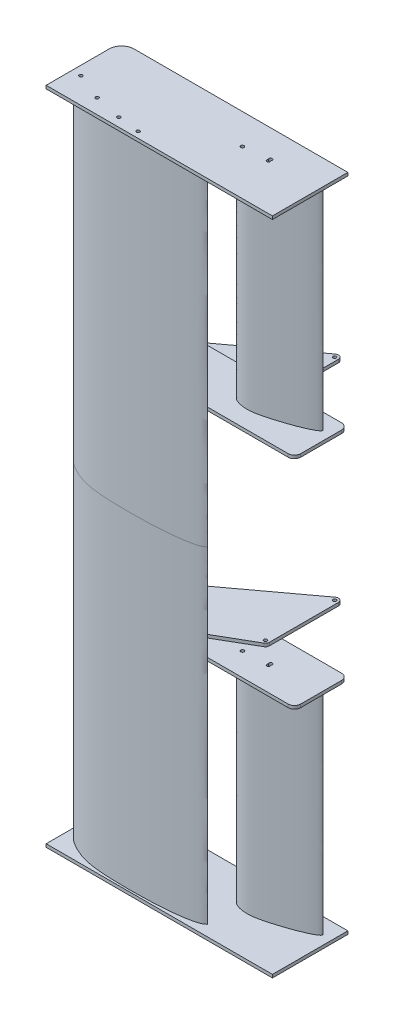
from build123d import *

# Parameters (mm, degrees)
MAIN_DEPTH              = 660.4
SKETCH2_W               = 457.2
SKETCH2_H               = 152.4
ENDPLATE_DEPTH          = 6.35
FILLET4_R               = 25.4
SECOND_DEPTH            = 438.15
SKETCH23_R              = 3.302
INNER_ENDPLATE_DEPTH    = 6.35
FILLET2_R               = 12.7
CUT_EXTRUDE4_DEPTH      = 676.928791664
CUT_EXTRUDE4_DEPTH_BACK = 676.928791664
SKETCH24_R              = 3.302
BRACKET_DEPTH           = 6.35
CUT_EXTRUDE1_DEPTH      = 1045.463627801
CUT_EXTRUDE1_DEPTH_BACK = 1045.463627801
SKETCH9_R               = 3.302


with BuildPart() as part:
    # Sketch1 → Main (new body)
    with BuildSketch(Plane(origin=(0, 0, 0), x_dir=(1, 0, 0), z_dir=(0, 1, 0))):
        with BuildLine():
            add(Edge.make_bspline(
                [(318.083845492, 47.259196978), (318.08297359, 47.267154189), (316.836850446, 46.62700977), (315.466403769, 46.011621914), (311.900786948, 44.424374903), (307.131660944, 42.819520456), (300.528834256, 41.236182285), (292.543042944, 39.972954123), (283.264489423, 39.014698092), (272.872069182, 38.443565802), (261.492469203, 38.305788402), (249.276802549, 38.627289353), (236.374254336, 39.434871831), (222.94005764, 40.719492576), (209.12856161, 42.470686101), (195.093442857, 44.665547934), (180.984437285, 47.25968123), (166.945903947, 50.201123123), (153.116363264, 53.441082277), (139.61983953, 56.894935575), (126.573330114, 60.495905864), (114.082486038, 64.157557775), (102.237618501, 67.797629829), (91.1177432, 71.324265433), (80.783504455, 74.640170192), (71.280367209, 77.687906441), (62.533724574, 80.261388665), (54.494573966, 82.320744222), (47.189919329, 84.053436628), (40.658043207, 85.472768156), (34.964856515, 86.556633324), (30.181047583, 87.352830974), (26.340381113, 87.686545767), (23.527915607, 87.890034883), (21.327636154, 87.155445312), (20.524324703, 85.231304501), (20.163398672, 83.070326582), (20.340649738, 80.44131285), (21.031931261, 77.531851422), (22.283339536, 74.403421576), (24.094422985, 71.123489385), (26.564942436, 67.774181889), (29.684577576, 64.383148263), (33.398862268, 60.924210695), (37.713795664, 57.460311883), (42.604896224, 54.034229147), (48.047577674, 50.681123894), (54.029926242, 47.457003136), (60.514509487, 44.379799377), (67.479018498, 41.505638203), (74.897272675, 38.873528205), (82.772968187, 36.57860894), (91.10761162, 34.617106723), (99.946095184, 33.070584061), (109.287355208, 31.901790166), (119.092438276, 30.937070462), (129.317209455, 30.231149487), (139.897617837, 29.72941602), (150.768654301, 29.397410733), (161.847925709, 29.18899276), (173.043707209, 29.09390494), (184.260705512, 29.091626097), (195.411742422, 29.202537859), (206.416770867, 29.431717071), (217.2049735, 29.775340643), (227.708273252, 30.244993817), (237.864632232, 30.825665152), (247.611165213, 31.522447797), (256.88943499, 32.319237716), (265.643009293, 33.213008254), (273.81964691, 34.197878974), (281.372108338, 35.26525725), (288.257812582, 36.40206553), (294.438418039, 37.603705661), (299.88101434, 38.857203766), (304.559654579, 40.152174252), (308.464413379, 41.463824945), (311.653686798, 42.920117293), (314.043297262, 44.459457329), (316.089209008, 45.930997418), (317.016522327, 46.641914263), (318.084700022, 47.251398314), (318.083845492, 47.259196978)],
                knots=[0, 0, 0, 0, 0.000999594, 0.004147435, 0.009748209, 0.018044377, 0.028864178, 0.04183079, 0.056713807, 0.073341232, 0.091507989, 0.111021837, 0.131661709, 0.153207715, 0.175433402, 0.198110317, 0.221011446, 0.243905882, 0.266573311, 0.288810349, 0.310405036, 0.331177743, 0.350943876, 0.3695564, 0.386864963, 0.402753039, 0.417195876, 0.430379519, 0.442362633, 0.453032156, 0.462284346, 0.470026206, 0.476176645, 0.480649947, 0.483553073, 0.486420689, 0.489953231, 0.494096927, 0.498850588, 0.50419675, 0.510125492, 0.516691031, 0.524011699, 0.532092122, 0.540897921, 0.550403414, 0.560581041, 0.571396483, 0.582828081, 0.594829641, 0.607347037, 0.620384325, 0.633968937, 0.648199967, 0.663193937, 0.678898581, 0.695226562, 0.712113221, 0.729459406, 0.747143117, 0.765009772, 0.782904928, 0.800688045, 0.818242105, 0.835449083, 0.852211621, 0.868429578, 0.884009363, 0.898854951, 0.912881827, 0.92601075, 0.938166771, 0.949289699, 0.959322172, 0.968216949, 0.97594822, 0.982474409, 0.987904723, 0.992516501, 0.996351138, 0.999020322, 1, 1, 1, 1], degree=3))
        make_face()
    extrude(amount=MAIN_DEPTH)


with BuildPart() as body_2:
    # Sketch2 → Endplate (new body)
    with BuildSketch(Plane(origin=(0, 660.4, 0), x_dir=(1, 0, 0), z_dir=(0, 1, 0))):
        with Locations((242.57, 101.6)):
            Rectangle(SKETCH2_W, SKETCH2_H)
    extrude(amount=ENDPLATE_DEPTH)

    # Fillet4
    fillet4_edges = [body_2.edges().sort_by_distance(p)[0] for p in [
        (13.97, 663.575, -177.8),
    ]]
    fillet(fillet4_edges, radius=FILLET4_R)


with BuildPart() as body_3:
    # Sketch3 → Second (new body)
    with BuildSketch(Plane(origin=(0, 660.4, 0), x_dir=(1, 0, 0), z_dir=(0, 1, 0))):
        with BuildLine():
            add(Edge.make_bspline(
                [(453.791162952, 145.42722665), (453.789582818, 145.430903949), (453.287326131, 144.942651799), (452.722004792, 144.448062717), (451.249129687, 143.16787405), (449.203367762, 141.70333033), (446.27767212, 139.981013571), (442.6439131, 138.209588311), (438.347434144, 136.395002656), (433.461765154, 134.602689583), (428.04072347, 132.873274469), (422.152774521, 131.241243271), (415.865333277, 129.741220746), (409.253946802, 128.391575714), (402.393947414, 127.209867743), (395.362164259, 126.20761035), (388.236684107, 125.385464349), (381.094128818, 124.739686823), (374.007864863, 124.267197804), (367.049565457, 123.945665146), (360.284935044, 123.760262553), (353.77712654, 123.685105434), (347.581347925, 123.694062486), (341.748808875, 123.754763237), (336.322729681, 123.829551483), (331.333246088, 123.8976096), (326.77481142, 123.849490836), (322.629823792, 123.658966509), (318.883790691, 123.419620339), (315.553072401, 123.143409206), (312.672415893, 122.829398564), (310.268633444, 122.510777177), (308.383425257, 122.108892598), (307.008890957, 121.795048735), (306.064208707, 121.122153258), (305.961385591, 120.084687984), (306.10471235, 118.998648974), (306.573789982, 117.767491404), (307.329649985, 116.477381083), (308.385346011, 115.164453098), (309.730799552, 113.860900499), (311.401705674, 112.620576146), (313.389087775, 111.455191876), (315.67072957, 110.344268526), (318.240298234, 109.318779289), (321.079834423, 108.395599386), (324.17244205, 107.587947162), (327.504237085, 106.92086088), (331.054699638, 106.397442914), (334.804957885, 106.0412686), (338.736791004, 105.867162755), (342.838058269, 105.921156912), (347.11003172, 106.201666917), (351.562253387, 106.754254682), (356.199660213, 107.560953161), (361.029012371, 108.533034566), (366.021206684, 109.690213663), (371.153600446, 110.99701463), (376.400146858, 112.427457244), (381.728194587, 113.94743443), (387.095384629, 115.538632824), (392.459152176, 117.177309647), (397.774833261, 118.860466206), (403.003411023, 120.578828254), (408.111582861, 122.320215279), (413.065103965, 124.080214888), (417.836505229, 125.842580262), (422.394973386, 127.600553772), (426.71492073, 129.337892543), (430.769806491, 131.044899771), (434.535511046, 132.711126788), (437.990702834, 134.32555926), (441.116933405, 135.875719386), (443.896541815, 137.353803549), (446.315688489, 138.748797228), (448.363485081, 140.051941457), (450.038810013, 141.249930848), (451.350879344, 142.412487151), (452.268447534, 143.497853492), (453.031586758, 144.500557237), (453.371057842, 144.976043905), (453.792711602, 145.42362262), (453.791162952, 145.42722665)],
                knots=[0, 0, 0, 0, 0.000999594, 0.004147435, 0.009748209, 0.018044377, 0.028864178, 0.04183079, 0.056713807, 0.073341232, 0.091507989, 0.111021837, 0.131661709, 0.153207715, 0.175433402, 0.198110317, 0.221011446, 0.243905882, 0.266573311, 0.288810349, 0.310405036, 0.331177743, 0.350943876, 0.3695564, 0.386864963, 0.402753039, 0.417195876, 0.430379519, 0.442362633, 0.453032156, 0.462284346, 0.470026206, 0.476176645, 0.480649947, 0.483553073, 0.486420689, 0.489953231, 0.494096927, 0.498850588, 0.50419675, 0.510125492, 0.516691031, 0.524011699, 0.532092122, 0.540897921, 0.550403414, 0.560581041, 0.571396483, 0.582828081, 0.594829641, 0.607347037, 0.620384325, 0.633968937, 0.648199967, 0.663193937, 0.678898581, 0.695226562, 0.712113221, 0.729459406, 0.747143117, 0.765009772, 0.782904928, 0.800688045, 0.818242105, 0.835449083, 0.852211621, 0.868429578, 0.884009363, 0.898854951, 0.912881827, 0.92601075, 0.938166771, 0.949289699, 0.959322172, 0.968216949, 0.97594822, 0.982474409, 0.987904723, 0.992516501, 0.996351138, 0.999020322, 1, 1, 1, 1], degree=3))
        make_face()
    extrude(amount=-SECOND_DEPTH)


with BuildPart() as body_4:
    # Sketch23 → Inner Endplate (new body)
    with BuildSketch(Plane.XZ.offset(-222.25)):
        with BuildLine():
            Line((57.603623129, -84.451529159), (168.884811336, -52.874392631))
            ThreePointArc((168.884811336, -52.874392631), (171.908658894, -52.643642451), (174.783029089, -53.610542486))
            Line((174.783029089, -53.610542486), (202.831083849, -69.85))
            Line((202.831083849, -69.85), (471.17, -69.85))
            Line((471.17, -69.85), (471.17, -177.8))
            Line((471.17, -177.8), (163.040808988, -177.8))
            Line((163.040808988, -177.8), (55.149058286, -97.905918497))
            ThreePointArc((55.149058286, -97.905918497), (52.187476766, -90.414524286), (57.603623129, -84.451529159))
        make_face()
        with Locations((330.2, -152.4)):
            Circle(SKETCH23_R, mode=Mode.SUBTRACT)
        with Locations((59.683749039, -91.782114142)):
            Circle(SKETCH23_R, mode=Mode.SUBTRACT)
        with Locations((170.964937246, -60.204977615)):
            Circle(SKETCH23_R, mode=Mode.SUBTRACT)
    extrude(amount=INNER_ENDPLATE_DEPTH)

    # Fillet2
    fillet2_edges = [body_4.edges().sort_by_distance(p)[0] for p in [
        (202.831083849, 219.075, -69.85),
        (471.17, 219.075, -69.85),
        (471.17, 219.075, -177.8),
        (163.040808988, 219.075, -177.8),
    ]]
    fillet(fillet2_edges, radius=FILLET2_R)


with BuildPart() as cut_extrude4_tool:
    # Sketch24 → Cut-Extrude4 (new, two sides: drawn at the far end of the back side and taken through both)
    with BuildSketch(Plane.XZ.offset(-215.9).offset(-CUT_EXTRUDE4_DEPTH_BACK)):
        with Locations((319.459191206, -116.582508471)):
            Circle(SKETCH24_R)
        with Locations((143.277879936, -43.131921136)):
            Circle(SKETCH24_R)
        with Locations((87.172963634, -55.138888562)):
            Circle(SKETCH24_R)
        with Locations((32.306239861, -77.230124888)):
            Circle(SKETCH24_R)
        with Locations((187.396556376, -37.714828821)):
            Circle(SKETCH24_R)
        with BuildLine():
            ThreePointArc((368.235920218, -119.966991334), (370.271857189, -125.664240866), (373.07512826, -120.30277065))
            ThreePointArc((373.07512826, -120.30277065), (371.039191289, -114.605521118), (368.235920218, -119.966991334))
        make_face()
    extrude(amount=CUT_EXTRUDE4_DEPTH + CUT_EXTRUDE4_DEPTH_BACK)


with BuildPart() as body_2_1:
    add(body_2.part)

    # Cut-Extrude4: cut by cut_extrude4_tool
    add(cut_extrude4_tool.part, mode=Mode.SUBTRACT)


with BuildPart() as body_4_1:
    add(body_4.part)

    # Cut-Extrude4: cut by cut_extrude4_tool
    add(cut_extrude4_tool.part, mode=Mode.SUBTRACT)


with BuildPart() as body_5:
    # Mirror1: mirrored copy
    add(body_2_1.part.mirror(Plane(origin=(21.295918577, 0, -76.987198967), x_dir=(0, 0, 1), z_dir=(0, -1, 0))))


with BuildPart() as body_6:
    # Mirror1 2: mirrored copy
    add(body_3.part.mirror(Plane(origin=(21.295918577, 0, -76.987198967), x_dir=(0, 0, 1), z_dir=(0, -1, 0))))


with BuildPart() as body_7:
    # Mirror1 3: mirrored copy
    add(part.part.mirror(Plane(origin=(21.295918577, 0, -76.987198967), x_dir=(0, 0, 1), z_dir=(0, -1, 0))))


with BuildPart() as body_8:
    # Mirror1 4: mirrored copy
    add(body_4_1.part.mirror(Plane(origin=(21.295918577, 0, -76.987198967), x_dir=(0, 0, 1), z_dir=(0, -1, 0))))


with BuildPart() as body_9:
    # Sketch8 → Bracket (new body)
    with BuildSketch(Plane.XZ.offset(-215.9)):
        with BuildLine():
            Line((55.149058286, -97.905918497), (325.665309247, -298.223804355))
            ThreePointArc((325.665309247, -298.223804355), (333.628560665, -298.905098954), (337.82, -292.1))
            Line((337.82, -292.1), (337.82, -152.4))
            ThreePointArc((337.82, -152.4), (336.801449078, -148.594048072), (334.018091844, -145.805564871))
            Line((334.018091844, -145.805564871), (174.783029089, -53.610542486))
            ThreePointArc((174.783029089, -53.610542486), (171.908658894, -52.643642451), (168.884811336, -52.874392631))
            Line((168.884811336, -52.874392631), (57.603623129, -84.451529159))
            ThreePointArc((57.603623129, -84.451529159), (52.187476766, -90.414524286), (55.149058286, -97.905918497))
        make_face()
    extrude(amount=BRACKET_DEPTH)

    # Sketch9 → Cut-Extrude1 (cut, two sides: drawn at the far end of the back side and taken through both)
    with BuildSketch(Plane.XZ.offset(-215.9).offset(-CUT_EXTRUDE1_DEPTH_BACK)):
        with Locations((59.683749039, -91.782114142)):
            Circle(SKETCH9_R)
        with Locations((170.964937246, -60.204977615)):
            Circle(SKETCH9_R)
        with Locations((330.2, -152.4)):
            Circle(SKETCH9_R)
        with Locations((330.2, -292.1)):
            Circle(SKETCH9_R)
    extrude(amount=CUT_EXTRUDE1_DEPTH + CUT_EXTRUDE1_DEPTH_BACK, mode=Mode.SUBTRACT)


with BuildPart() as body_10:
    # Mirror2: mirrored copy
    add(body_9.part.mirror(Plane.ZX))


solid = Compound([part.part, body_3.part, body_2_1.part, body_4_1.part, body_5.part, body_6.part, body_7.part, body_8.part, body_9.part, body_10.part])
